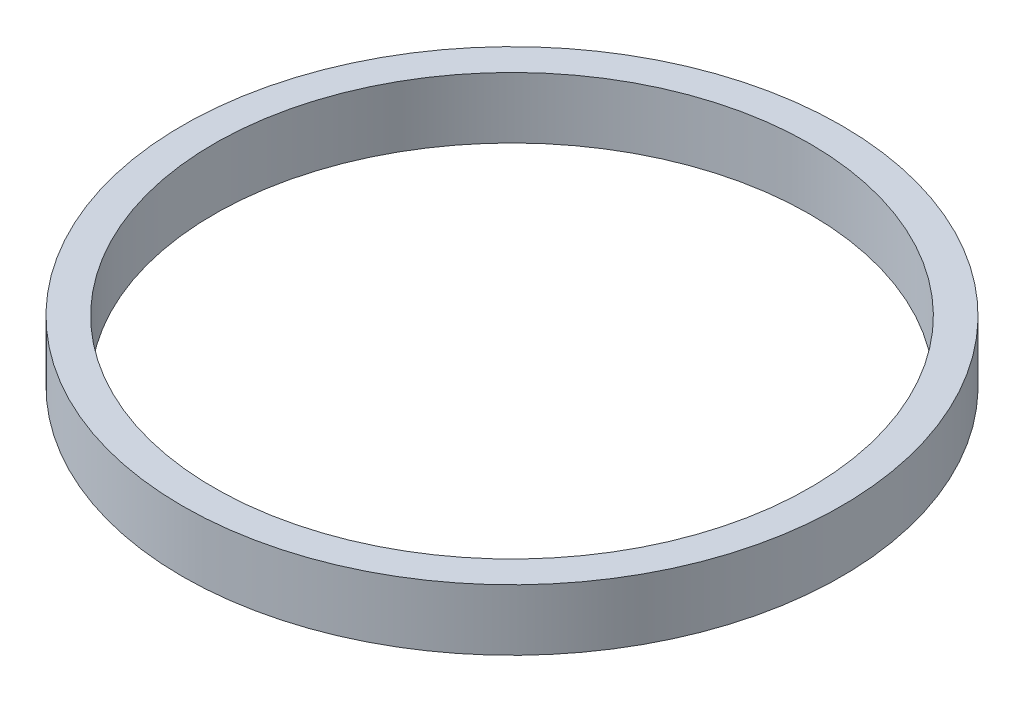
from build123d import *

# Parameters (mm, degrees)
SKETCH1_W = 1.3462
SKETCH1_H = 2.6035


with BuildPart() as part:
    # Sketch1 → Revolve1 (revolve)
    with BuildSketch(Plane.XY, mode=Mode.PRIVATE) as revolve1_sk:
        with Locations((-13.3731, 1.30175)):
            Rectangle(SKETCH1_W, SKETCH1_H)
    revolve(revolve1_sk.sketch.rotate(Axis((0, 0, 0), (0, 1, 0)), 270), axis=Axis((0, 0, 0), (0, 1, 0)))


solid = part.part
